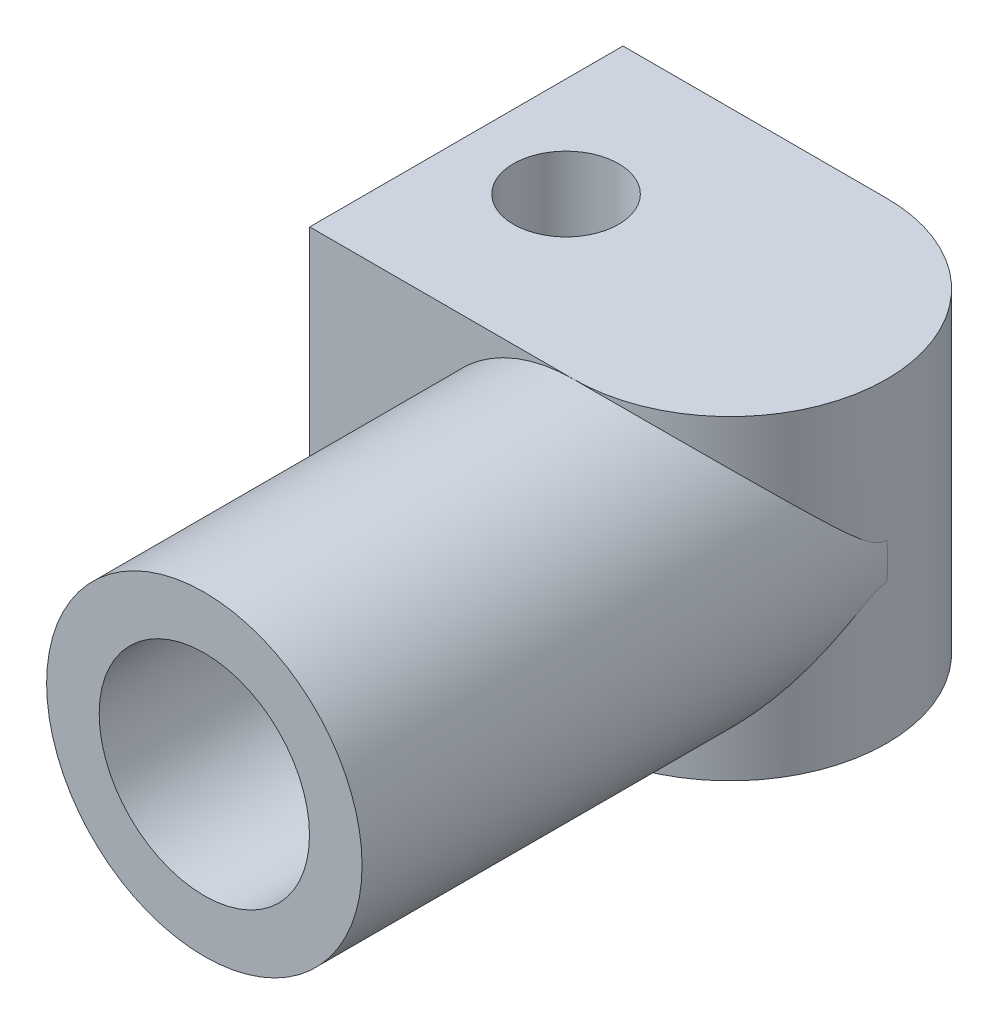
from build123d import *

# Parameters (mm, degrees)
SKETCH1_R           = 7.5
SKETCH1_R_2         = 5
BOSS_EXTRUDE1_DEPTH = 25
BOSS_EXTRUDE3_DEPTH = 7.5
SKETCH5_R           = 2.5
CUT_EXTRUDE3_DEPTH  = 15


with BuildPart() as part:
    # Sketch1 → Boss-Extrude1 (new body)
    with BuildSketch(Plane.XY):
        Circle(SKETCH1_R)
        Circle(SKETCH1_R_2, mode=Mode.SUBTRACT)
    extrude(amount=BOSS_EXTRUDE1_DEPTH)

    # Sketch4 → Boss-Extrude3 (add, symmetric)
    with BuildSketch(Plane(origin=(0, 0, 0), x_dir=(1, 0, 0), z_dir=(0, 1, 0))):
        with BuildLine():
            Line((0, -7.449392631), (-9.305010791, -7.449392631))
            Line((-9.305010791, -7.449392631), (-12.541569439, -7.449392631))
            Line((-12.541569439, -7.449392631), (-12.541569439, 7.449392631))
            Line((-12.541569439, 7.449392631), (-9.305010791, 7.449392631))
            Line((-9.305010791, 7.449392631), (0, 7.449392631))
            ThreePointArc((0, 7.449392631), (7.449392631, 0), (0, -7.449392631))
        make_face()
    extrude(amount=BOSS_EXTRUDE3_DEPTH, both=True)

    # Sketch5 → Cut-Extrude3 (cut)
    with BuildSketch(Plane(origin=(0, 7.5, 0), x_dir=(1, 0, 0), z_dir=(0, 1, 0))):
        with Locations(Location((-7.8, 0, 0), (0, 0, 270))):
            Circle(SKETCH5_R)
    extrude(amount=-CUT_EXTRUDE3_DEPTH, mode=Mode.SUBTRACT)


solid = part.part
